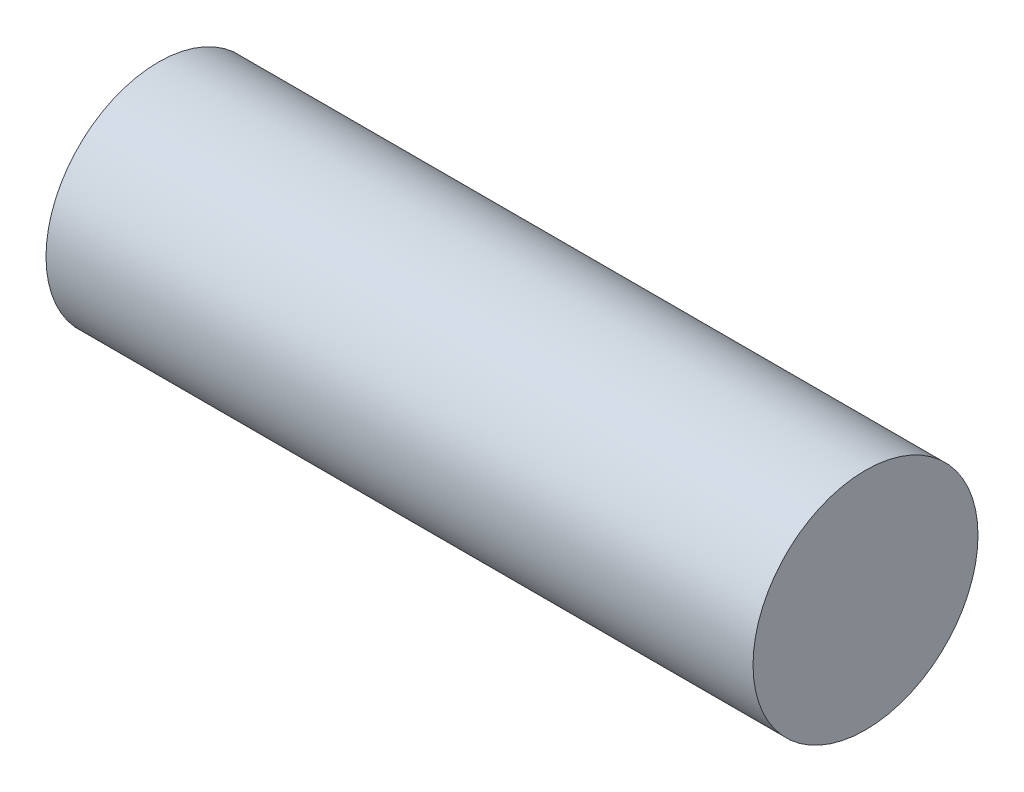
from build123d import *

# Parameters (mm, degrees)
SKETCH1_R           = 1.75
BOSS_EXTRUDE1_DEPTH = 5.5


with BuildPart() as part:
    # Sketch1 → Boss-Extrude1 (new, symmetric)
    with BuildSketch(Plane(origin=(0, 0, 0), x_dir=(0, 0, -1), z_dir=(1, 0, 0))):
        Circle(SKETCH1_R)
    extrude(amount=BOSS_EXTRUDE1_DEPTH, both=True)


solid = part.part
